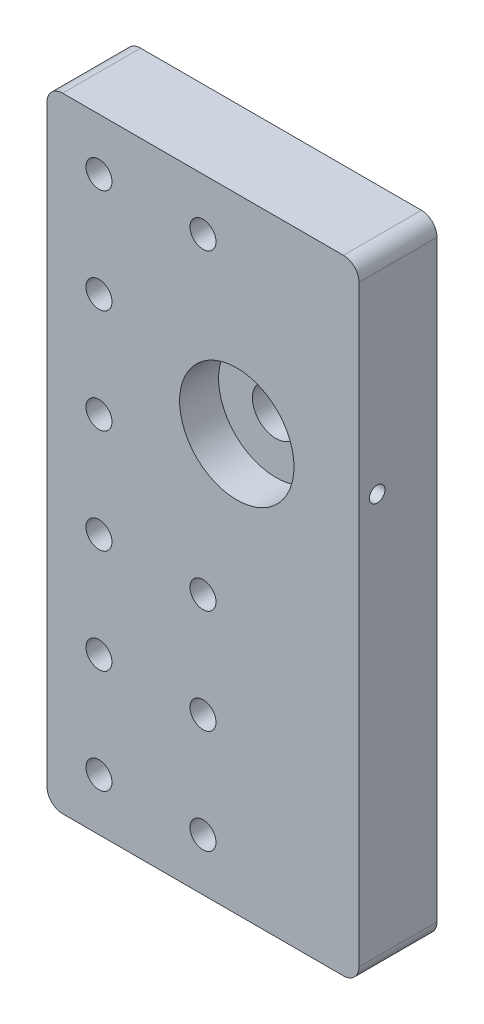
from build123d import *

# Parameters (mm, degrees)
SKETCH1_W           = 60
SKETCH1_H           = 120
SKETCH1_R           = 2.5
BOSS_EXTRUDE1_DEPTH = 15
FILLET1_R           = 3
SKETCH2_R           = 4.5
CUT_EXTRUDE1_DEPTH  = 136
SKETCH2_3_R         = 11
SKETCH2_3_R_2       = 4.5
CUT_EXTRUDE2_DEPTH  = 7.5
CUT_EXTRUDE3_REACH  = 137
SKETCH3_R           = 1.5


with BuildPart() as part:
    # Sketch1 → Boss-Extrude1 (new body)
    with BuildSketch(Plane.XY):
        with Locations((30, 60)):
            Rectangle(SKETCH1_W, SKETCH1_H)
        with Locations((10, 110)):
            Circle(SKETCH1_R, mode=Mode.SUBTRACT)
        with Locations((30, 110)):
            Circle(SKETCH1_R, mode=Mode.SUBTRACT)
        with Locations((10, 90)):
            Circle(SKETCH1_R, mode=Mode.SUBTRACT)
        with Locations((10, 70)):
            Circle(SKETCH1_R, mode=Mode.SUBTRACT)
        with Locations((10, 10)):
            Circle(SKETCH1_R, mode=Mode.SUBTRACT)
        with Locations((30, 10)):
            Circle(SKETCH1_R, mode=Mode.SUBTRACT)
        with Locations((30, 50)):
            Circle(SKETCH1_R, mode=Mode.SUBTRACT)
        with Locations((10, 50)):
            Circle(SKETCH1_R, mode=Mode.SUBTRACT)
        with Locations((10, 30)):
            Circle(SKETCH1_R, mode=Mode.SUBTRACT)
        with Locations((30, 30)):
            Circle(SKETCH1_R, mode=Mode.SUBTRACT)
    extrude(amount=BOSS_EXTRUDE1_DEPTH)

    # Fillet1
    fillet1_edges = [part.edges().sort_by_distance(p)[0] for p in [
        (0, 0, 7.5),
        (60, 0, 7.5),
        (0, 120, 7.5),
        (60, 120, 7.5),
    ]]
    fillet(fillet1_edges, radius=FILLET1_R)

    # Sketch2 → Cut-Extrude1 (cut, through all)
    with BuildSketch(Plane.XY.offset(15)):
        with Locations((36.5, 80)):
            Circle(SKETCH2_R)
    extrude(amount=-CUT_EXTRUDE1_DEPTH, mode=Mode.SUBTRACT)

    # Sketch2<3> → Cut-Extrude2 (cut)
    with BuildSketch(Plane.XY.offset(15)):
        with Locations((36.5, 80)):
            Circle(SKETCH2_3_R)
        with Locations((36.5, 80)):
            Circle(SKETCH2_3_R_2, mode=Mode.SUBTRACT)
    extrude(amount=-CUT_EXTRUDE2_DEPTH, mode=Mode.SUBTRACT)

    # Sketch3 → Cut-Extrude3 (cut, up to next)
    with BuildSketch(Plane(origin=(60, 0, 0), x_dir=(0, 0, -1), z_dir=(1, 0, 0)), mode=Mode.PRIVATE) as cut_extrude3_sk1:
        with Locations((-11.5, 80)):
            Circle(SKETCH3_R)
    cut_extrude3_tool1 = extrude(cut_extrude3_sk1.sketch, amount=-CUT_EXTRUDE3_REACH, mode=Mode.PRIVATE) & part.part
    add(cut_extrude3_tool1.solids().sort_by_distance((60, 80, 11.5))[0], mode=Mode.SUBTRACT)


solid = part.part
